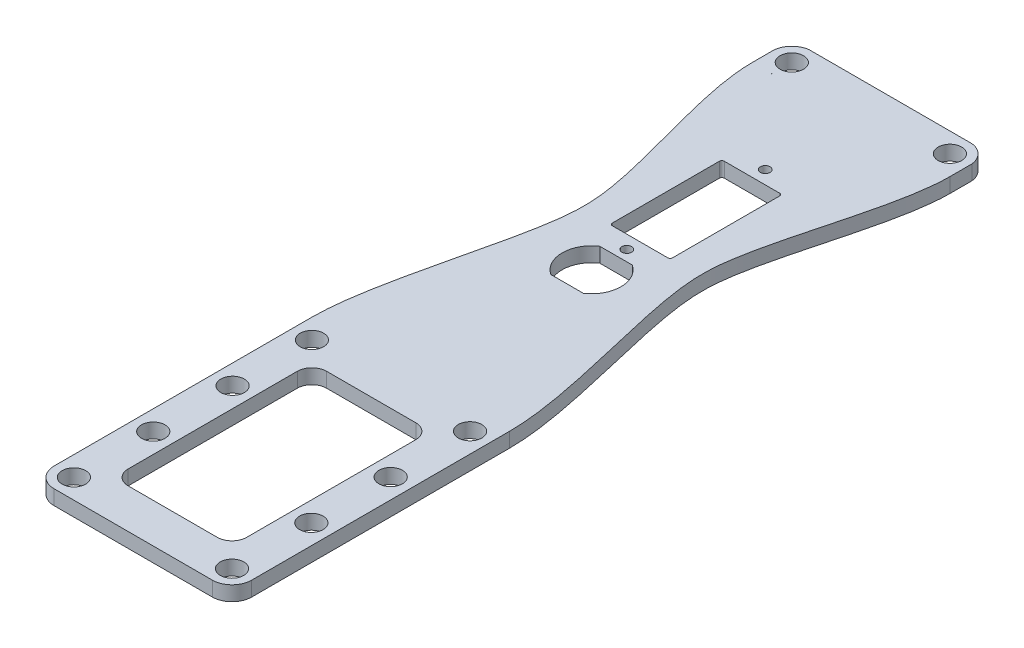
from build123d import *

# Parameters (mm, degrees)
SKETCH2_R           = 2.4
BOSS_EXTRUDE1_DEPTH = 3
CUT_EXTRUDE1_DEPTH  = 10
SKETCH4_W           = 6.633249581
SKETCH4_H           = 10
CUT_EXTRUDE2_DEPTH  = 10


with BuildPart() as part:
    # Sketch2 → Boss-Extrude1 (new body)
    with BuildSketch(Plane(origin=(0, 0, 0), x_dir=(1, 0, 0), z_dir=(0, 1, 0))):
        with BuildLine():
            Line((37.095668531, 36.137061002), (3.882090118, 36.137061002))
            ThreePointArc((3.882090118, 36.137061002), (1.472078995, 34.973861332), (0.308879325, 32.563850209))
            Line((0.308879325, 32.563850209), (0.308879325, 28.067061002))
            add(Edge.make_bspline(
                [(0.383185823, -61.932938998), (0.383185823, -49.55331966), (8.593306341, -25.568302829), (8.562984639, -3.223049243), (0.308879325, 17.163416192), (0.308879325, 28.067061002)],
                knots=[0, 0, 0, 0, 0.447162615, 0.547162615, 1, 1, 1, 1], degree=3))
            Line((0.383185823, -61.932938998), (0.383185823, -114.493630956))
            Line((0.383185823, -114.493630956), (0.383185823, -114.642243953))
            ThreePointArc((0.383185823, -114.642243953), (1.564526203, -117.421597075), (4.343879325, -118.602937455))
            Line((4.343879325, -118.602937455), (36.782492321, -118.602937455))
            ThreePointArc((36.782492321, -118.602937455), (39.561845443, -117.421597075), (40.743185823, -114.642243953))
            Line((40.743185823, -114.642243953), (40.743185823, -114.493630956))
            Line((40.743185823, -114.493630956), (40.743185823, -61.932938998))
            add(Edge.make_bspline(
                [(40.743185823, -61.932938998), (40.743185823, -49.55331966), (32.526457787, -25.568302829), (32.571301302, -3.223049243), (40.668879325, 17.163416192), (40.668879325, 28.067061002)],
                knots=[0, 0, 0, 0, 0.447162615, 0.547162615, 1, 1, 1, 1], degree=3))
            Line((40.668879325, 28.067061002), (40.668879325, 32.563850209))
            ThreePointArc((40.668879325, 32.563850209), (39.505679655, 34.973861332), (37.095668531, 36.137061002))
        make_face()
        with BuildLine():
            Line((3.882090118, 28.067061002), (4.805668531, 28.067061002))
            ThreePointArc((4.805668531, 28.067061002), (4.343879325, 28.040722027), (3.882090118, 28.067061002))
        make_face(mode=Mode.SUBTRACT)
        with Locations(Location((4.343879325, 32.102061002, 0), (0, 0, 270))):
            Circle(SKETCH2_R, mode=Mode.SUBTRACT)
        with Locations(Location((36.633879325, 32.102061002, 0), (0, 0, 270))):
            Circle(SKETCH2_R, mode=Mode.SUBTRACT)
        with Locations(Location((4.418185823, -114.567937455, 0), (0, 0, 270))):
            Circle(SKETCH2_R, mode=Mode.SUBTRACT)
        with Locations(Location((4.423185823, -98.367938226, 0), (0, 0, 270))):
            Circle(SKETCH2_R, mode=Mode.SUBTRACT)
        with Locations(Location((36.708185823, -114.567937455, 0), (0, 0, 270))):
            Circle(SKETCH2_R, mode=Mode.SUBTRACT)
        with Locations(Location((36.703185823, -98.367938226, 0), (0, 0, 270))):
            Circle(SKETCH2_R, mode=Mode.SUBTRACT)
        with Locations(Location((4.423185823, -82.167938226, 0), (0, 0, 270))):
            Circle(SKETCH2_R, mode=Mode.SUBTRACT)
        with Locations(Location((4.418185823, -65.967938998, 0), (0, 0, 270))):
            Circle(SKETCH2_R, mode=Mode.SUBTRACT)
        with BuildLine():
            ThreePointArc((8.463185823, -73.002938998), (9.34186548, -70.881618654), (11.463185823, -70.002938998))
            Line((11.463185823, -70.002938998), (29.663185823, -70.002938998))
            ThreePointArc((29.663185823, -70.002938998), (31.784506167, -70.881618654), (32.663185823, -73.002938998))
            Line((32.663185823, -73.002938998), (32.663185823, -107.532937455))
            ThreePointArc((32.663185823, -107.532937455), (31.784506167, -109.654257798), (29.663185823, -110.532937455))
            Line((29.663185823, -110.532937455), (11.463185823, -110.532937455))
            ThreePointArc((11.463185823, -110.532937455), (9.34186548, -109.654257798), (8.463185823, -107.532937455))
            Line((8.463185823, -107.532937455), (8.463185823, -73.002938998))
        make_face(mode=Mode.SUBTRACT)
        with Locations(Location((36.703185823, -82.167938226, 0), (0, 0, 270))):
            Circle(SKETCH2_R, mode=Mode.SUBTRACT)
        with Locations(Location((36.708185823, -65.967938998, 0), (0, 0, 270))):
            Circle(SKETCH2_R, mode=Mode.SUBTRACT)
    extrude(amount=BOSS_EXTRUDE1_DEPTH)

    # Sketch3 → Cut-Extrude1 (cut)
    with BuildSketch(Plane(origin=(0, 3, 0), x_dir=(1, 0, 0), z_dir=(0, 1, 0))):
        with BuildLine():
            ThreePointArc((21.563185823, -17.802938998), (20.063185823, -16.936913594), (20.063185823, -18.668964402))
            ThreePointArc((20.063185823, -18.668964402), (20.563185823, -18.802938998), (21.063185823, -18.668964402))
            ThreePointArc((21.063185823, -18.668964402), (21.429211227, -18.302938998), (21.563185823, -17.802938998))
        make_face()
        with BuildLine():
            ThreePointArc((21.063185823, 11.313086406), (20.563185823, 11.447061002), (20.063185823, 11.313086406))
            ThreePointArc((20.063185823, 11.313086406), (20.063185823, 9.581035598), (21.563185823, 10.447061002))
            ThreePointArc((21.563185823, 10.447061002), (21.429211227, 10.947061002), (21.063185823, 11.313086406))
        make_face()
        with BuildLine():
            Line((14.413185823, -14.602938998), (14.413185823, 7.247061002))
            ThreePointArc((14.413185823, 7.247061002), (14.559632433, 7.600614393), (14.913185823, 7.747061002))
            Line((14.913185823, 7.747061002), (26.213185823, 7.747061002))
            ThreePointArc((26.213185823, 7.747061002), (26.566739214, 7.600614393), (26.713185823, 7.247061002))
            Line((26.713185823, 7.247061002), (26.713185823, -14.602938998))
            ThreePointArc((26.713185823, -14.602938998), (26.566739214, -14.956492388), (26.213185823, -15.102938998))
            Line((26.213185823, -15.102938998), (14.913185823, -15.102938998))
            ThreePointArc((14.913185823, -15.102938998), (14.559632433, -14.956492388), (14.413185823, -14.602938998))
        make_face()
    extrude(amount=-CUT_EXTRUDE1_DEPTH, mode=Mode.SUBTRACT)

    # Sketch4 → Cut-Extrude2 (cut)
    with BuildSketch(Plane(origin=(0, 3, 0), x_dir=(1, 0, 0), z_dir=(0, 1, 0))):
        with Locations((20.563185823, -25.002938998)):
            Rectangle(SKETCH4_W, SKETCH4_H)
        with BuildLine():
            Line((23.879810614, -20.002938998), (23.879810614, -30.002938998))
            ThreePointArc((23.879810614, -30.002938998), (25.849949897, -27.840213329), (26.563185823, -25.002938998))
            ThreePointArc((26.563185823, -25.002938998), (25.849949897, -22.165664667), (23.879810614, -20.002938998))
        make_face()
        with BuildLine():
            ThreePointArc((17.246561033, -20.002938998), (14.563185823, -25.002938998), (17.246561033, -30.002938998))
            Line((17.246561033, -30.002938998), (17.246561033, -20.002938998))
        make_face()
    extrude(amount=-CUT_EXTRUDE2_DEPTH, mode=Mode.SUBTRACT)


solid = part.part
